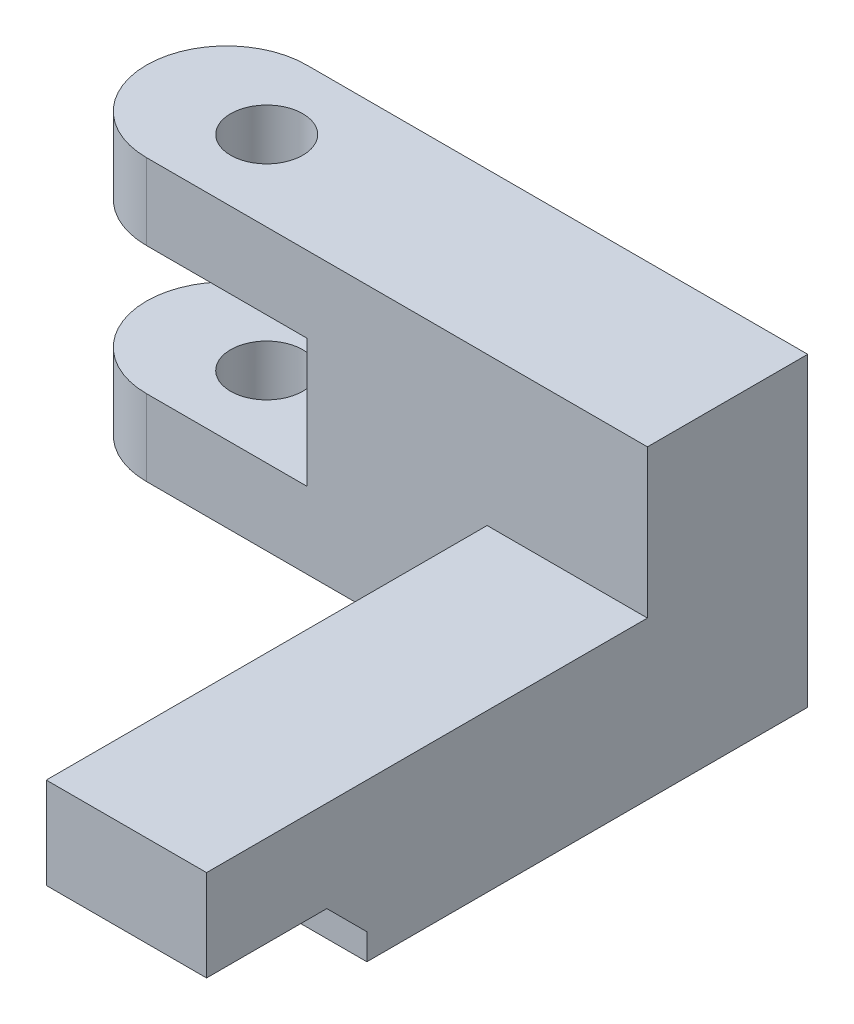
from build123d import *

# Parameters (mm, degrees)
SKETCH1_R           = 0.9
BOSS_EXTRUDE1_DEPTH = 7
CUT_EXTRUDE1_REACH  = 21.129
SKETCH2_W           = 6
SKETCH2_H           = 3.2
SKETCH3_W           = 11
SKETCH3_H           = 3.7
CUT_EXTRUDE2_DEPTH  = 4
SKETCH6_W           = 4
SKETCH6_H           = 15
BOSS_EXTRUDE2_DEPTH = 0.6275
CUT_EXTRUDE3_REACH  = 24.006


with BuildPart() as part:
    # Sketch1 → Boss-Extrude1 (new body)
    with BuildSketch(Plane(origin=(0, 0, 0), x_dir=(1, 0, 0), z_dir=(0, 1, 0))):
        with BuildLine():
            Line((1.496941475, 0), (13.996941475, 0))
            Line((13.996941475, 0), (13.996941475, -15))
            Line((13.996941475, -15), (9.996941475, -15))
            Line((9.996941475, -15), (9.996941475, -4))
            Line((9.996941475, -4), (1.496941475, -4))
            ThreePointArc((1.496941475, -4), (-0.503058525, -2), (1.496941475, 0))
        make_face()
        with Locations(Location((2.496941475, -2, 0), (0, 0, 270))):
            Circle(SKETCH1_R, mode=Mode.SUBTRACT)
    extrude(amount=BOSS_EXTRUDE1_DEPTH)

    # Sketch2 → Cut-Extrude1 (cut, up to next)
    with BuildSketch(Plane.XY.offset(4), mode=Mode.PRIVATE) as cut_extrude1_sk1:
        with Locations((2.496941475, 3.5)):
            Rectangle(SKETCH2_W, SKETCH2_H)
    cut_extrude1_tool1 = extrude(cut_extrude1_sk1.sketch, amount=-CUT_EXTRUDE1_REACH, mode=Mode.PRIVATE) & part.part
    add(cut_extrude1_tool1.solids().sort_by_distance((2.496941, 3.5, 4))[0], mode=Mode.SUBTRACT)

    # Sketch3 → Cut-Extrude2 (cut)
    with BuildSketch(Plane(origin=(13.996941475, 0, 0), x_dir=(0, 0, -1), z_dir=(1, 0, 0))):
        with Locations((-9.5, 5.15)):
            Rectangle(SKETCH3_W, SKETCH3_H)
    extrude(amount=-CUT_EXTRUDE2_DEPTH, mode=Mode.SUBTRACT)

    # Sketch6 → Boss-Extrude2 (add)
    with BuildSketch(Plane.XZ):
        with Locations((11.996941475, 7.5)):
            Rectangle(SKETCH6_W, SKETCH6_H)
    extrude(amount=BOSS_EXTRUDE2_DEPTH)

    # Sketch4 → Cut-Extrude3 (cut, up to next)
    with BuildSketch(Plane(origin=(13.996941475, 0, 0), x_dir=(0, 0, -1), z_dir=(1, 0, 0)), mode=Mode.PRIVATE) as cut_extrude3_sk1:
        Polygon((-11, -0.6275), (-15, -0.6275), (-15, 1.0225), (-12, 1.0225), (-11, 0.0225), align=None)
    cut_extrude3_tool1 = extrude(cut_extrude3_sk1.sketch, amount=-CUT_EXTRUDE3_REACH, mode=Mode.PRIVATE) & part.part
    add(cut_extrude3_tool1.solids().sort_by_distance((13.996941, 0.157199, 13.136612))[0], mode=Mode.SUBTRACT)


solid = part.part
